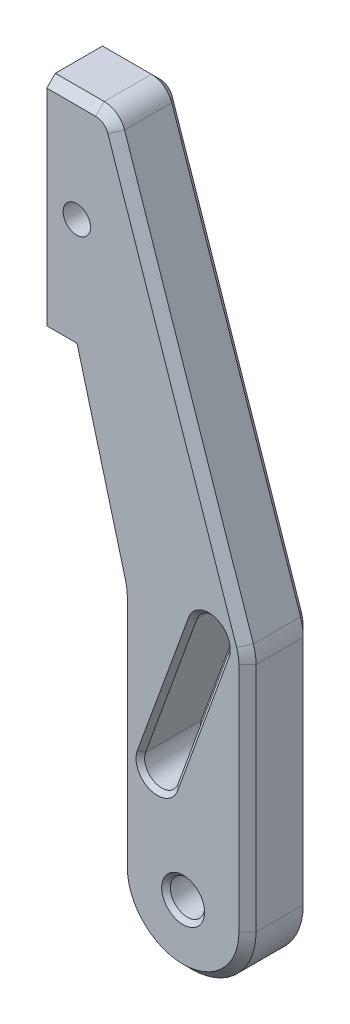
from build123d import *

# Parameters (mm, degrees)
CROQUIS1_R              = 4
SALIENTE_EXTRUIR1_DEPTH = 7.5
CROQUIS2_R              = 3.19
CORTAR_EXTRUIR1_DEPTH   = 155.064651655
REDONDEO1_R             = 12
CHAFL_N1_SIZE           = 1
REDONDEO2_R             = 5
CHAFL_N2_SIZE           = 2
CHAFL_N3_SIZE           = 1


with BuildPart() as part:
    # Croquis1 → Saliente-Extruir1 (new, symmetric)
    with BuildSketch(Plane.XY):
        with BuildLine():
            Line((-15, 0), (-15, 55.980762114))
            Line((-15, 55.980762114), (-26.794919243, 100))
            Line((-26.794919243, 100), (-31.794919243, 100))
            Line((-31.794919243, 100), (-31.794919243, 150))
            Line((-31.794919243, 150), (-16.794919243, 150))
            Line((-16.794919243, 150), (15, 55.980762114))
            Line((15, 55.980762114), (15, 0))
            ThreePointArc((15, 0), (0, -15), (-15, 0))
        make_face()
        Circle(CROQUIS1_R, mode=Mode.SUBTRACT)
        with BuildLine():
            Line((9.744122991, 54.61268154), (-2.226582025, 21.723439813))
            ThreePointArc((-2.226582025, 21.723439813), (-7.353433082, 19.332749903), (-9.744122991, 24.459600959))
            Line((-9.744122991, 24.459600959), (2.226582025, 57.348842687))
            ThreePointArc((2.226582025, 57.348842687), (7.353433082, 59.739532597), (9.744122991, 54.61268154))
        make_face(mode=Mode.SUBTRACT)
    extrude(amount=SALIENTE_EXTRUIR1_DEPTH, both=True)

    # Croquis2 → Cortar-Extruir1 (cut, through all)
    with BuildSketch(Plane.XY.offset(7.5)):
        with Locations((-24.794919243, 125)):
            Circle(CROQUIS2_R)
    extrude(amount=-CORTAR_EXTRUIR1_DEPTH, mode=Mode.SUBTRACT)

    # Redondeo1
    redondeo1_edges = [part.edges().sort_by_distance(p)[0] for p in [
        (-15, 55.980762114, 0),
        (15, 55.980762114, 0),
    ]]
    fillet(redondeo1_edges, radius=REDONDEO1_R)

    # Chaflán1
    chafl_n1_edges = [part.edges().sort_by_distance(p)[0] for p in [
        (-4, 0, -7.5),
        (-4, 0, 7.5),
    ]]
    chamfer(chafl_n1_edges, length=CHAFL_N1_SIZE)

    # Redondeo2
    redondeo2_edges = [part.edges().sort_by_distance(p)[0] for p in [
        (-16.794919243, 150, 0),
    ]]
    fillet(redondeo2_edges, radius=REDONDEO2_R)

    # Chaflán2
    chafl_n2_edges = [part.edges().sort_by_distance(p)[0] for p in [
        (15, 27.00331421, -7.5),
        (0, -15, -7.5),
        (-21.101904664, 78.753380342, 7.5),
        (0, -15, 7.5),
        (-15, 27.200466071, -7.5),
        (-15, 27.200466071, 7.5),
        (-0.639069755, 102.226308716, -7.5),
        (-0.639069755, 102.226308716, 7.5),
        (14.840839938, 55.95457851, -7.5),
        (14.840839938, 55.95457851, 7.5),
        (-15.102661664, 55.967246449, -7.5),
        (-15.102661664, 55.967246449, 7.5),
        (-26.088566443, 150, -7.5),
        (-26.088566443, 150, 7.5),
        (-17.467493018, 149.062561222, -7.5),
        (-17.467493018, 149.062561222, 7.5),
        (15, 27.00331421, 7.5),
        (-21.101904664, 78.753380342, -7.5),
    ]]
    chamfer(chafl_n2_edges, length=CHAFL_N2_SIZE)

    # Chaflán3
    chafl_n3_edges = [part.edges().sort_by_distance(p)[0] for p in [
        (7.353433082, 59.739532597, -7.5),
        (-3.758770483, 40.904221823, -7.5),
        (-7.353433082, 19.332749903, -7.5),
        (3.758770483, 38.168060676, -7.5),
        (7.353433082, 59.739532597, 7.5),
        (-3.758770483, 40.904221823, 7.5),
        (-7.353433082, 19.332749903, 7.5),
        (3.758770483, 38.168060676, 7.5),
    ]]
    chamfer(chafl_n3_edges, length=CHAFL_N3_SIZE)


solid = part.part
